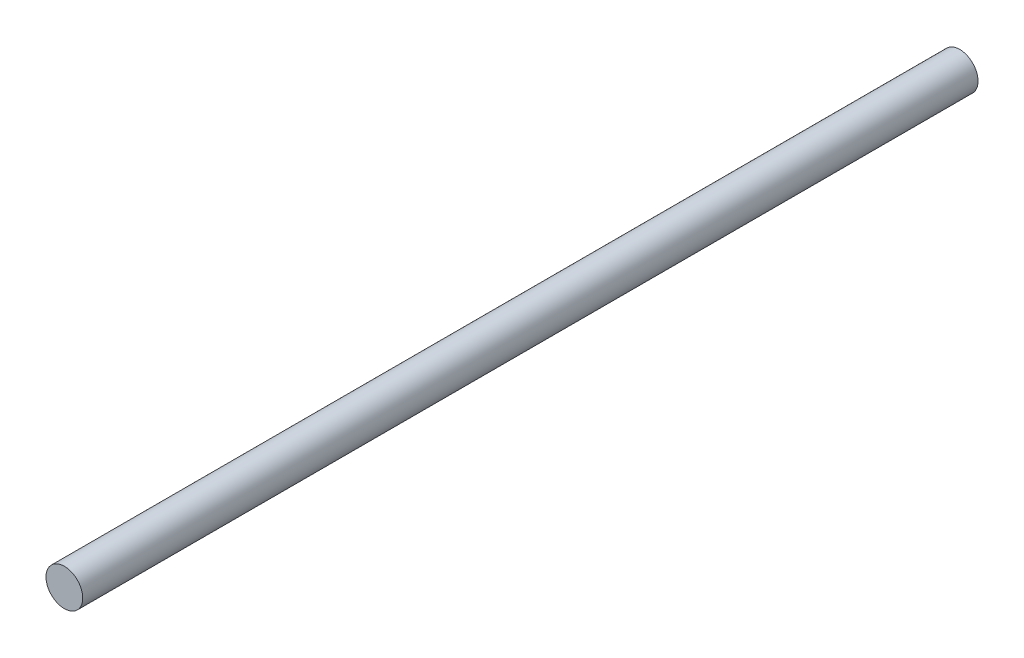
from build123d import *

# Parameters (mm, degrees)
SKETCH1_R           = 25
BOSS_EXTRUDE1_DEPTH = 1219.2


with BuildPart() as part:
    # Sketch1 → Boss-Extrude1 (new body)
    with BuildSketch(Plane.XY):
        with Locations(Location((0, 0, 0), (0, 0, 180))):
            Circle(SKETCH1_R)
    extrude(amount=BOSS_EXTRUDE1_DEPTH)


solid = part.part
